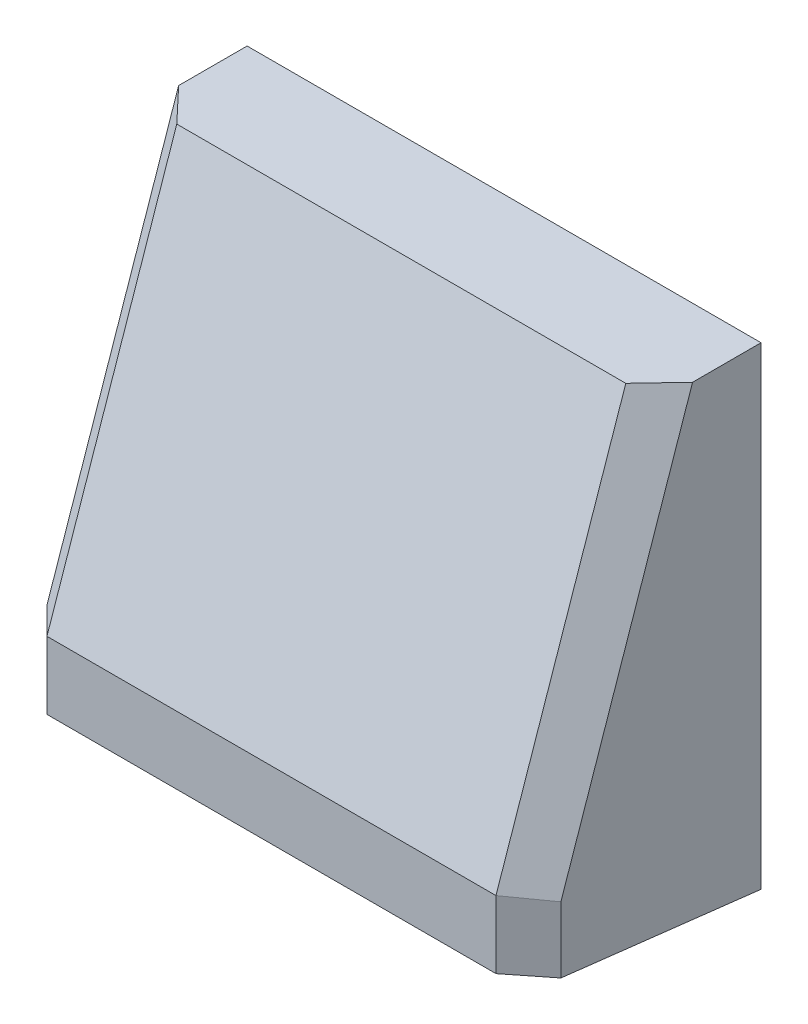
from build123d import *

# Parameters (mm, degrees)
SLOPED_COVER_BLANK_DEPTH                        = 95
SLOPED_COVER_BLANK_DEPTH_BACK                   = 95
OPEN_BOTTOM_AND_FRONT_COVER_CAVITY_DEPTH        = 80
OPEN_BOTTOM_AND_FRONT_COVER_CAVITY_DEPTH_BACK   = 80
F_12_MM_FULL_LENGTH_SHAPE_DEFINING_ROOF_CH_SIZE = 12


with BuildPart() as part:
    # Sloped Cover Outer Side Profile → Sloped Cover Blank (new, two sides: drawn at the far end of the back side and taken through both)
    with BuildSketch(Plane(origin=(0, 0, 0), x_dir=(0, 0, -1), z_dir=(1, 0, 0)).offset(-SLOPED_COVER_BLANK_DEPTH_BACK)):
        Polygon((-22, 25), (-22, 200), (-60, 200), (-108, 60), (-108, 35), align=None)
    extrude(amount=SLOPED_COVER_BLANK_DEPTH + SLOPED_COVER_BLANK_DEPTH_BACK)

    # Open Bottom Cover Cavity Profile → Open Bottom and Front Cover Cavity (cut, two sides: drawn at the far end of the back side and taken through both)
    with BuildSketch(Plane(origin=(0, 0, 0), x_dir=(0, 0, -1), z_dir=(1, 0, 0)).offset(-OPEN_BOTTOM_AND_FRONT_COVER_CAVITY_DEPTH_BACK)):
        Polygon((-18, 23), (-18, 193), (-48, 193), (-96, 60), (-96, 33.604651163), align=None)
    extrude(amount=OPEN_BOTTOM_AND_FRONT_COVER_CAVITY_DEPTH + OPEN_BOTTOM_AND_FRONT_COVER_CAVITY_DEPTH_BACK, mode=Mode.SUBTRACT)

    # 12 mm Full-Length Shape-Defining Roof Chamfers
    f_12_mm_full_length_shape_defining_roof_ch_edges = [part.edges().sort_by_distance(p)[0] for p in [
        (95, 130, 84),
        (95, 47.5, 108),
        (-95, 130, 84),
        (-95, 47.5, 108),
    ]]
    chamfer(f_12_mm_full_length_shape_defining_roof_ch_edges, length=F_12_MM_FULL_LENGTH_SHAPE_DEFINING_ROOF_CH_SIZE)


solid = part.part
